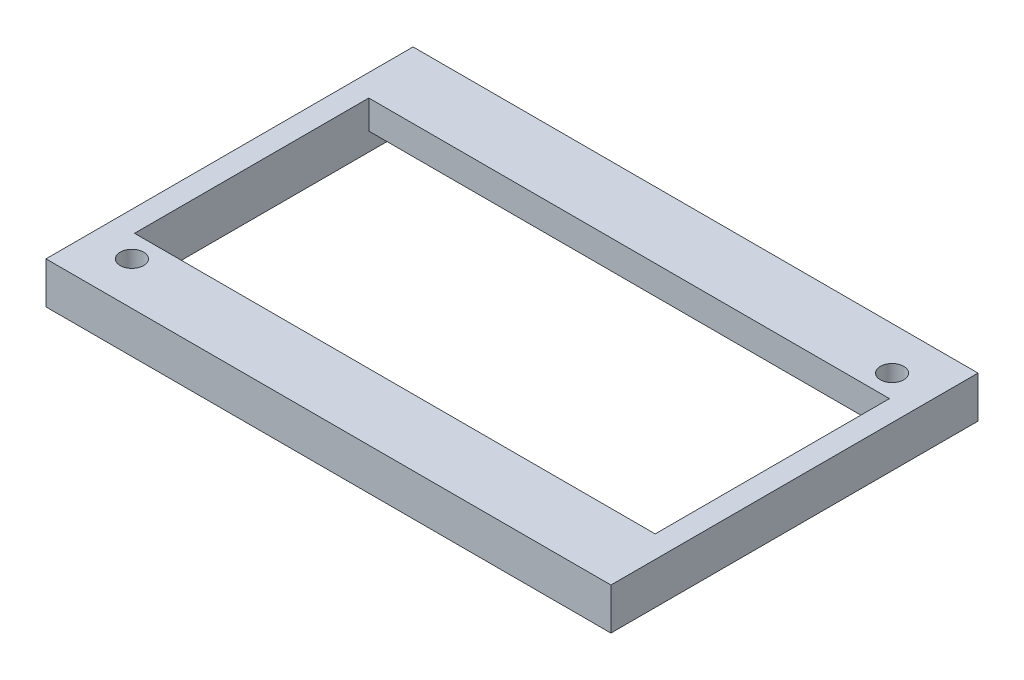
from build123d import *

# Parameters (mm, degrees)
SKETCH1_W           = 108.5
SKETCH1_H           = 70.5
BOSS_EXTRUDE1_DEPTH = 8
SKETCH3_W           = 102.5
SKETCH3_H           = 64.5
BOSS_EXTRUDE2_DEPTH = 1
SKETCH2_W           = 100
SKETCH2_H           = 45
CUT_EXTRUDE2_DEPTH  = 66.319407529
SKETCH4_W           = 100
SKETCH4_H           = 60.5
CUT_EXTRUDE3_DEPTH  = 3.5
SKETCH8_R           = 2.25
CUT_EXTRUDE6_DEPTH  = 66.319407529


with BuildPart() as part:
    # Sketch1 → Boss-Extrude1 (new body)
    with BuildSketch(Plane(origin=(0, 0, 0), x_dir=(1, 0, 0), z_dir=(0, 1, 0))):
        Rectangle(SKETCH1_W, SKETCH1_H)
    extrude(amount=BOSS_EXTRUDE1_DEPTH)

    # Sketch3 → Boss-Extrude2 (add)
    with BuildSketch(Plane.XZ):
        Rectangle(SKETCH3_W, SKETCH3_H)
    extrude(amount=BOSS_EXTRUDE2_DEPTH)

    # Sketch2 → Cut-Extrude2 (cut, through all)
    with BuildSketch(Plane(origin=(0, 8, 0), x_dir=(1, 0, 0), z_dir=(0, 1, 0))):
        Rectangle(SKETCH2_W, SKETCH2_H)
    extrude(amount=-CUT_EXTRUDE2_DEPTH, mode=Mode.SUBTRACT)

    # Sketch4 → Cut-Extrude3 (cut)
    with BuildSketch(Plane.XZ.offset(1)):
        Rectangle(SKETCH4_W, SKETCH4_H)
    extrude(amount=-CUT_EXTRUDE3_DEPTH, mode=Mode.SUBTRACT)

    # Sketch8 → Cut-Extrude6 (cut, through all)
    with BuildSketch(Plane(origin=(0, 8, 0), x_dir=(1, 0, 0), z_dir=(0, 1, 0))):
        with Locations(Location((-46, -27, 0), (0, 0, 270))):
            Circle(SKETCH8_R)
        with Locations(Location((46, 27, 0), (0, 0, 270))):
            Circle(SKETCH8_R)
    extrude(amount=-CUT_EXTRUDE6_DEPTH, mode=Mode.SUBTRACT)


solid = part.part
